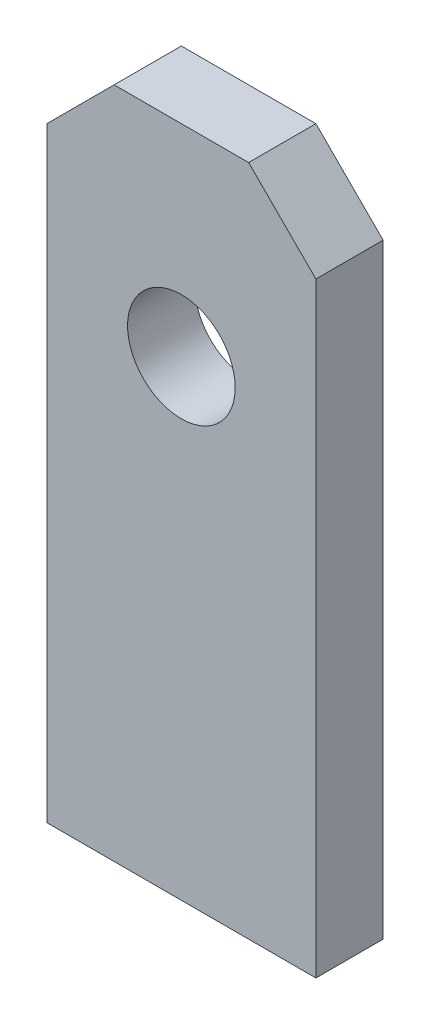
from build123d import *

# Parameters (mm, degrees)
BOSS_EXTRUDE1_DEPTH = 10
SKETCH2_R           = 8
CUT_EXTRUDE1_DEPTH  = 10


with BuildPart() as part:
    # Sketch1 → Boss-Extrude1 (new body)
    with BuildSketch(Plane.XY):
        Polygon((20, 0), (-20, 0), (-20, 90), (-10, 100), (10, 100), (20, 90), align=None)
    extrude(amount=BOSS_EXTRUDE1_DEPTH)

    # Sketch2 → Cut-Extrude1 (cut)
    with BuildSketch(Plane.XY.offset(10)):
        with Locations((0, 70)):
            Circle(SKETCH2_R)
    extrude(amount=-CUT_EXTRUDE1_DEPTH, mode=Mode.SUBTRACT)


solid = part.part
